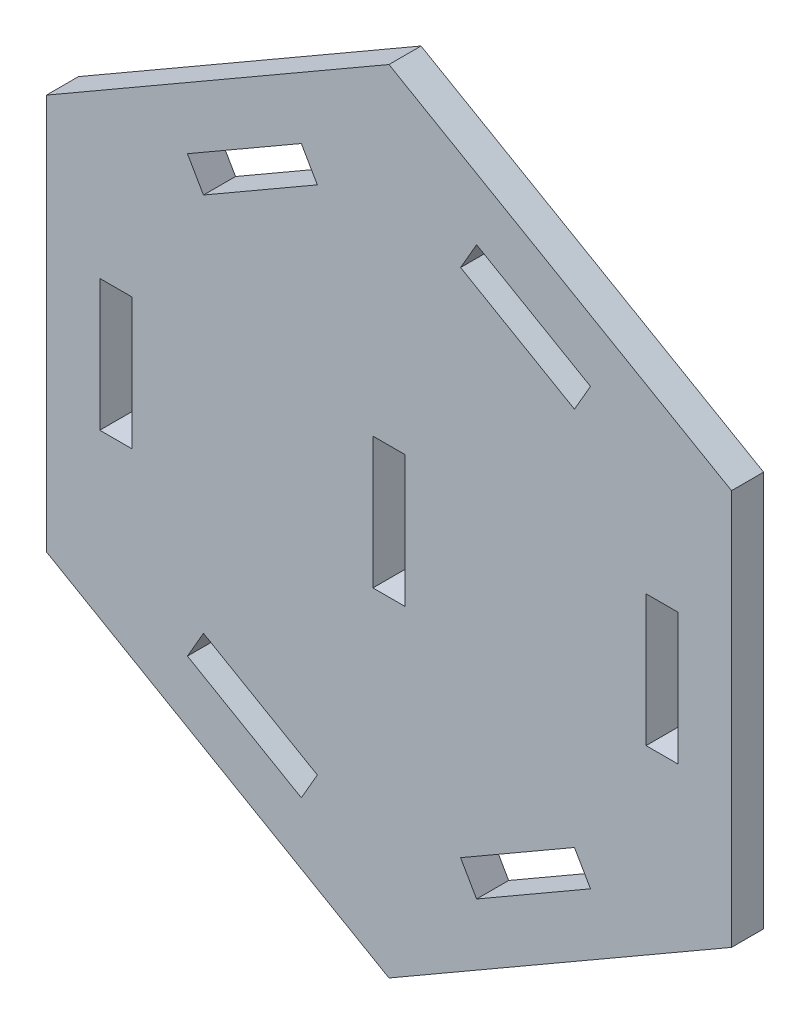
from build123d import *

# Parameters (mm, degrees)
CROQUIS1_W              = 3
CROQUIS1_H              = 12.3
SALIENTE_EXTRUIR1_DEPTH = 3


with BuildPart() as part:
    # Croquis1 → Saliente-Extruir1 (new body)
    with BuildSketch(Plane.XY):
        Polygon((383.208104606, -14.552616351), (415.251044546, 3.947383649), (415.251044546, 40.947383649), (383.208104606, 59.447383649), (351.165164666, 40.947383649), (351.165164666, 3.947383649), align=None)
        with Locations((383.208104606, 22.447383649)):
            Rectangle(CROQUIS1_W, CROQUIS1_H, mode=Mode.SUBTRACT)
        with Locations((408.75763007, 22.447383649)):
            Rectangle(CROQUIS1_W, CROQUIS1_H, mode=Mode.SUBTRACT)
        with Locations((357.658579143, 22.447383649)):
            Rectangle(CROQUIS1_W, CROQUIS1_H, mode=Mode.SUBTRACT)
        Polygon((389.906811105, 46.349883649), (400.558923571, 40.199883649), (402.058923571, 42.797959861), (391.406811105, 48.947959861), align=None, mode=Mode.SUBTRACT)
        Polygon((365.857285642, 40.199883649), (364.357285642, 42.797959861), (375.009398108, 48.947959861), (376.509398108, 46.349883649), align=None, mode=Mode.SUBTRACT)
        Polygon((376.509398108, -1.455116351), (365.857285642, 4.694883649), (364.357285642, 2.096807438), (375.009398108, -4.053192562), align=None, mode=Mode.SUBTRACT)
        Polygon((400.558923571, 4.694883649), (402.058923571, 2.096807438), (391.406811105, -4.053192562), (389.906811105, -1.455116351), align=None, mode=Mode.SUBTRACT)
    extrude(amount=SALIENTE_EXTRUIR1_DEPTH)


solid = part.part
